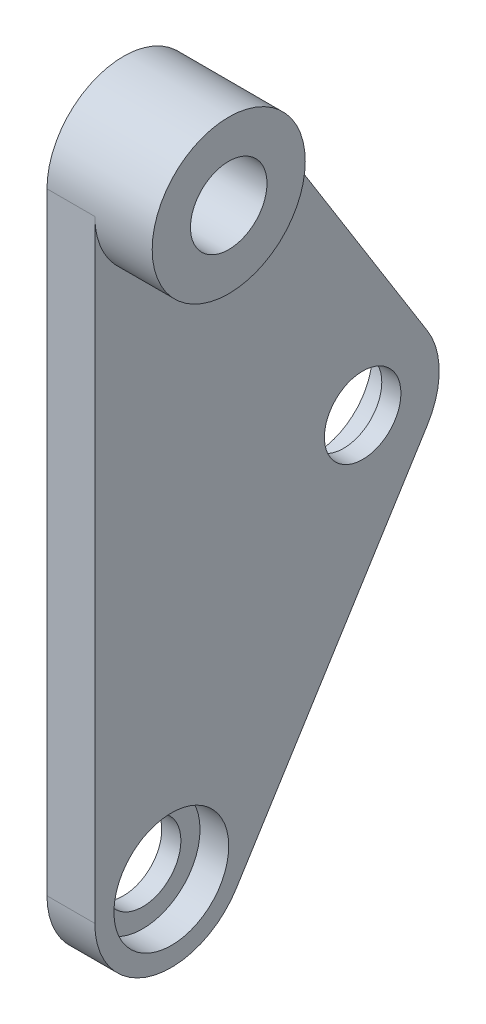
from build123d import *
from build123d.topology import SkipClean

# Parameters (mm, degrees)
EXTRUDE_1_DEPTH          = 2.5
EXTRUDE_START            = -3
SKETCH_1_4_R             = 4
EXTRUDE_2_DEPTH          = 3
CUT_EXTRUDE_1_DEPTH      = 44.965895874
CUT_EXTRUDE_1_DEPTH_BACK = 44.965895874
SKETCH_1_3_R             = 2
SKETCH_2_R               = 3
CUT_EXTRUDE_2_DEPTH      = 1.5
CUT_EXTRUDE_START        = -2.5
SKETCH_2_3_R             = 3
CUT_EXTRUDE_3_DEPTH      = 1.5
SKETCH_3_W               = 7.983418506
SKETCH_3_H               = 52.149860593
CUT_EXTRUDE_4_DEPTH      = 45.988887517


with BuildPart() as part:
    # 草图1 → 凸台-拉伸1 (new body)
    with BuildSketch(Plane(origin=(0, 0, 0), x_dir=(0, 0, -1), z_dir=(1, 0, 0))):
        with BuildLine():
            Line((17.391993216, -17.88000424), (7.391993216, -1.88000424))
            ThreePointArc((7.391993216, -1.88000424), (2.897269948, -0.155005015), (0, -4))
            Line((0, -4), (0, -36))
            ThreePointArc((0, -36), (2.897269948, -39.844994985), (7.391993216, -38.11999576))
            Line((7.391993216, -38.11999576), (17.391993216, -22.11999576))
            ThreePointArc((17.391993216, -22.11999576), (18, -20), (17.391993216, -17.88000424))
        make_face()
    extrude(amount=EXTRUDE_1_DEPTH)

    # 草图1<4> → 凸台-拉伸2 (add)
    with SkipClean():  # the faces are left unmerged after this step: merging them gives an invalid solid
        with BuildSketch(Plane(origin=(0, 0, 0), x_dir=(0, 0, -1), z_dir=(1, 0, 0)).offset(EXTRUDE_START)):
            with Locations(Location((4, -4, 0), (0, 0, 180))):
                Circle(SKETCH_1_4_R)
        extrude(amount=EXTRUDE_2_DEPTH)

    # 草图1<3> → 切除-拉伸1 (cut, two sides: drawn at the far end of the back side and taken through both)
    with SkipClean():  # the faces are left unmerged after this step: merging them gives an invalid solid
        with BuildSketch(Plane(origin=(0, 0, 0), x_dir=(0, 0, -1), z_dir=(1, 0, 0)).offset(-CUT_EXTRUDE_1_DEPTH_BACK)):
            with Locations((4, -4)):
                Circle(SKETCH_1_3_R)
            with Locations((14, -20)):
                Circle(SKETCH_1_3_R)
            with Locations((4, -36)):
                Circle(SKETCH_1_3_R)
        extrude(amount=CUT_EXTRUDE_1_DEPTH + CUT_EXTRUDE_1_DEPTH_BACK, mode=Mode.SUBTRACT)

    # 草图2 → 切除-拉伸2 (cut)
    with SkipClean():  # the faces are left unmerged after this step: merging them gives an invalid solid
        with BuildSketch(Plane(origin=(2.5, 0, 0), x_dir=(0, 0, -1), z_dir=(1, 0, 0))):
            with Locations((4, -4)):
                Circle(SKETCH_2_R)
            with Locations((14, -20)):
                Circle(SKETCH_2_R)
        extrude(amount=-CUT_EXTRUDE_2_DEPTH, mode=Mode.SUBTRACT)

    # 草图2<3> → 切除-拉伸3 (cut)
    with SkipClean():  # the faces are left unmerged after this step: merging them gives an invalid solid
        with BuildSketch(Plane(origin=(2.5, 0, 0), x_dir=(0, 0, -1), z_dir=(1, 0, 0)).offset(CUT_EXTRUDE_START)):
            with Locations((4, -36)):
                Circle(SKETCH_2_3_R)
        extrude(amount=CUT_EXTRUDE_3_DEPTH, mode=Mode.SUBTRACT)


with BuildPart() as body_2:
    # 镜向2: mirrored copy
    add(part.part.mirror(Plane(origin=(3.5, 0, 0), x_dir=(0, 0, 1), z_dir=(1, 0, 0))))


with BuildPart() as part_1:
    add(part.part)

    # 草图3 → 切除-拉伸4 (cut, through all)
    with BuildSketch(Plane.XY):
        with Locations((-0.565425098, -20.529857361)):
            Rectangle(SKETCH_3_W, SKETCH_3_H)
    extrude(amount=-CUT_EXTRUDE_4_DEPTH, mode=Mode.SUBTRACT)


solid = body_2.part
